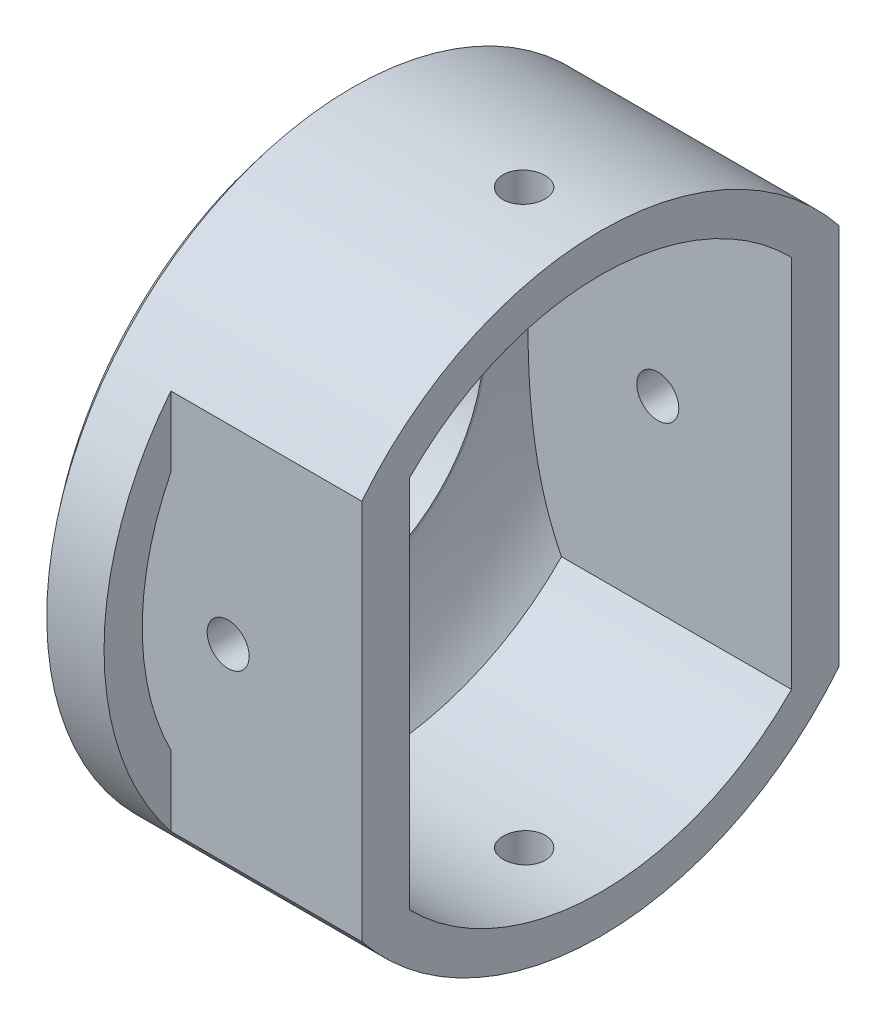
from build123d import *
from build123d.topology import SkipClean

# Parameters (mm, degrees)
SHELL1_T                                   = -2
CUT_EXTRUDE1_REACH                         = 24.978
SKETCH2_R                                  = 7.9
BOSS_EXTRUDE1_DEPTH                        = 10
BOSS_EXTRUDE1_DIRECTION_2_REACH            = 25.409
BOSS_EXTRUDE1_DIRECTION_2_END_MAJOR_RADIUS = 8
BOSS_EXTRUDE1_DIRECTION_2_END_MINOR_RADIUS = 10.166666667
SKETCH4_R                                  = 1.1
CUT_EXTRUDE2_DEPTH                         = 35.179672481
BOSS_EXTRUDE3_DEPTH                        = 10
SKETCH6_R                                  = 1.1
CUT_EXTRUDE3_DEPTH                         = 22.5


with BuildPart() as part:
    # Sketch1 → Revolve1 (revolve)
    with BuildSketch(Plane.XY):
        with BuildLine():
            Line((0, 0), (0, 16))
            Line((0, 16), (-3, 16))
            ThreePointArc((-3, 16), (-5.225338327, 12.272001873), (-6, 8))
            Line((-6, 8), (-6, 0))
            Line((-6, 0), (0, 0))
        make_face()
    revolve(axis=Axis((0, 0, 0), (-1, 0, 0)))

    # Shell1
    shell1_openings = [part.faces().sort_by_distance(p)[0] for p in [
        (0, 0, 0),
    ]]
    offset(amount=SHELL1_T, openings=shell1_openings, kind=Kind.INTERSECTION)

    # Sketch2 → Cut-Extrude1 (cut, up to next)
    with BuildSketch(Plane(origin=(-4, 0, 0), x_dir=(0, 0, -1), z_dir=(1, 0, 0)), mode=Mode.PRIVATE) as cut_extrude1_sk1:
        with Locations(Location((0, 0, 0), (0, 0, 90))):
            Circle(SKETCH2_R)
    cut_extrude1_tool1 = extrude(cut_extrude1_sk1.sketch, amount=-CUT_EXTRUDE1_REACH, mode=Mode.PRIVATE) & part.part
    add(cut_extrude1_tool1.solids().sort_by_distance((-4, 0, 0))[0], mode=Mode.SUBTRACT)

    # Sketch3 → Boss-Extrude1 (add)
    with BuildSketch(Plane(origin=(0, 0, 0), x_dir=(0, 0, -1), z_dir=(1, 0, 0))):
        with BuildLine():
            Line((-10, -9.797958971), (-10, 9.797958971))
            ThreePointArc((-10, 9.797958971), (-11.384775342, 8.14781507), (-12.5, 6.304760106))
            Line((-12.5, 6.304760106), (-12.5, -6.304760106))
            ThreePointArc((-12.5, -6.304760106), (-11.384775342, -8.14781507), (-10, -9.797958971))
        make_face()
        with BuildLine():
            ThreePointArc((12.5, 6.304760106), (11.384775342, 8.14781507), (10, 9.797958971))
            Line((10, 9.797958971), (10, -9.797958971))
            ThreePointArc((10, -9.797958971), (11.384775342, -8.14781507), (12.5, -6.304760106))
            Line((12.5, -6.304760106), (12.5, 6.304760106))
        make_face()
        with BuildLine():
            Line((-10, 9.797958971), (-10, 9.987492178))
            Line((-10, 9.987492178), (-12.5, 9.987492178))
            Line((-12.5, 9.987492178), (-12.5, 6.304760106))
            ThreePointArc((-12.5, 6.304760106), (-11.384775342, 8.14781507), (-10, 9.797958971))
        make_face()
        with BuildLine():
            Line((-10, -9.987492178), (-10, -9.797958971))
            ThreePointArc((-10, -9.797958971), (-11.384775342, -8.14781507), (-12.5, -6.304760106))
            Line((-12.5, -6.304760106), (-12.5, -9.987492178))
            Line((-12.5, -9.987492178), (-10, -9.987492178))
        make_face()
        with BuildLine():
            ThreePointArc((12.5, -6.304760106), (11.384775342, -8.14781507), (10, -9.797958971))
            Line((10, -9.797958971), (10, -9.987492178))
            Line((10, -9.987492178), (12.5, -9.987492178))
            Line((12.5, -9.987492178), (12.5, -6.304760106))
        make_face()
        with BuildLine():
            Line((10, 9.987492178), (10, 9.797958971))
            ThreePointArc((10, 9.797958971), (11.384775342, 8.14781507), (12.5, 6.304760106))
            Line((12.5, 6.304760106), (12.5, 9.987492178))
            Line((12.5, 9.987492178), (10, 9.987492178))
        make_face()
    extrude(amount=BOSS_EXTRUDE1_DEPTH)

    # Boss-Extrude1 direction 2: up to this torus (the profile starts inside it)
    boss_extrude1_direction_2_end = Plane(origin=(6.166666667, 0, 0), z_dir=(1, 0, 0)) * Torus(BOSS_EXTRUDE1_DIRECTION_2_END_MAJOR_RADIUS, BOSS_EXTRUDE1_DIRECTION_2_END_MINOR_RADIUS, mode=Mode.PRIVATE)
    # Sketch3 → Boss-Extrude1 direction 2 (add, up to the surface)
    with BuildSketch(Plane(origin=(0, 0, 0), x_dir=(0, 0, -1), z_dir=(1, 0, 0)), mode=Mode.PRIVATE) as boss_extrude1_direction_2_sk1:
        with BuildLine():
            Line((-10, -9.797958971), (-10, 9.797958971))
            ThreePointArc((-10, 9.797958971), (-11.384775342, 8.14781507), (-12.5, 6.304760106))
            Line((-12.5, 6.304760106), (-12.5, -6.304760106))
            ThreePointArc((-12.5, -6.304760106), (-11.384775342, -8.14781507), (-10, -9.797958971))
        make_face()
    boss_extrude1_direction_2_tool1 = extrude(boss_extrude1_direction_2_sk1.sketch, amount=-BOSS_EXTRUDE1_DIRECTION_2_REACH, mode=Mode.PRIVATE) & boss_extrude1_direction_2_end
    add(boss_extrude1_direction_2_tool1.solids().sort_by_distance((0, 0, 11.16294))[0])
    # Sketch3 → Boss-Extrude1 direction 2 (add, up to the surface)
    with BuildSketch(Plane(origin=(0, 0, 0), x_dir=(0, 0, -1), z_dir=(1, 0, 0)), mode=Mode.PRIVATE) as boss_extrude1_direction_2_sk2:
        with BuildLine():
            ThreePointArc((12.5, 6.304760106), (11.384775342, 8.14781507), (10, 9.797958971))
            Line((10, 9.797958971), (10, -9.797958971))
            ThreePointArc((10, -9.797958971), (11.384775342, -8.14781507), (12.5, -6.304760106))
            Line((12.5, -6.304760106), (12.5, 6.304760106))
        make_face()
    boss_extrude1_direction_2_tool2 = extrude(boss_extrude1_direction_2_sk2.sketch, amount=-BOSS_EXTRUDE1_DIRECTION_2_REACH, mode=Mode.PRIVATE) & boss_extrude1_direction_2_end
    add(boss_extrude1_direction_2_tool2.solids().sort_by_distance((0, 0, -11.16294))[0])
    # Sketch3 → Boss-Extrude1 direction 2 (add, up to the surface)
    with BuildSketch(Plane(origin=(0, 0, 0), x_dir=(0, 0, -1), z_dir=(1, 0, 0)), mode=Mode.PRIVATE) as boss_extrude1_direction_2_sk3:
        with BuildLine():
            Line((-10, 9.797958971), (-10, 9.987492178))
            Line((-10, 9.987492178), (-12.5, 9.987492178))
            Line((-12.5, 9.987492178), (-12.5, 6.304760106))
            ThreePointArc((-12.5, 6.304760106), (-11.384775342, 8.14781507), (-10, 9.797958971))
        make_face()
    boss_extrude1_direction_2_tool3 = extrude(boss_extrude1_direction_2_sk3.sketch, amount=-BOSS_EXTRUDE1_DIRECTION_2_REACH, mode=Mode.PRIVATE) & boss_extrude1_direction_2_end
    add(boss_extrude1_direction_2_tool3.solids().sort_by_distance((0, 8.829417, 11.660924))[0])
    # Sketch3 → Boss-Extrude1 direction 2 (add, up to the surface)
    with BuildSketch(Plane(origin=(0, 0, 0), x_dir=(0, 0, -1), z_dir=(1, 0, 0)), mode=Mode.PRIVATE) as boss_extrude1_direction_2_sk4:
        with BuildLine():
            Line((-10, -9.987492178), (-10, -9.797958971))
            ThreePointArc((-10, -9.797958971), (-11.384775342, -8.14781507), (-12.5, -6.304760106))
            Line((-12.5, -6.304760106), (-12.5, -9.987492178))
            Line((-12.5, -9.987492178), (-10, -9.987492178))
        make_face()
    boss_extrude1_direction_2_tool4 = extrude(boss_extrude1_direction_2_sk4.sketch, amount=-BOSS_EXTRUDE1_DIRECTION_2_REACH, mode=Mode.PRIVATE) & boss_extrude1_direction_2_end
    add(boss_extrude1_direction_2_tool4.solids().sort_by_distance((0, -8.829417, 11.660924))[0])
    # Sketch3 → Boss-Extrude1 direction 2 (add, up to the surface)
    with BuildSketch(Plane(origin=(0, 0, 0), x_dir=(0, 0, -1), z_dir=(1, 0, 0)), mode=Mode.PRIVATE) as boss_extrude1_direction_2_sk5:
        with BuildLine():
            ThreePointArc((12.5, -6.304760106), (11.384775342, -8.14781507), (10, -9.797958971))
            Line((10, -9.797958971), (10, -9.987492178))
            Line((10, -9.987492178), (12.5, -9.987492178))
            Line((12.5, -9.987492178), (12.5, -6.304760106))
        make_face()
    boss_extrude1_direction_2_tool5 = extrude(boss_extrude1_direction_2_sk5.sketch, amount=-BOSS_EXTRUDE1_DIRECTION_2_REACH, mode=Mode.PRIVATE) & boss_extrude1_direction_2_end
    add(boss_extrude1_direction_2_tool5.solids().sort_by_distance((0, -8.829417, -11.660924))[0])
    # Sketch3 → Boss-Extrude1 direction 2 (add, up to the surface)
    with BuildSketch(Plane(origin=(0, 0, 0), x_dir=(0, 0, -1), z_dir=(1, 0, 0)), mode=Mode.PRIVATE) as boss_extrude1_direction_2_sk6:
        with BuildLine():
            Line((10, 9.987492178), (10, 9.797958971))
            ThreePointArc((10, 9.797958971), (11.384775342, 8.14781507), (12.5, 6.304760106))
            Line((12.5, 6.304760106), (12.5, 9.987492178))
            Line((12.5, 9.987492178), (10, 9.987492178))
        make_face()
    boss_extrude1_direction_2_tool6 = extrude(boss_extrude1_direction_2_sk6.sketch, amount=-BOSS_EXTRUDE1_DIRECTION_2_REACH, mode=Mode.PRIVATE) & boss_extrude1_direction_2_end
    add(boss_extrude1_direction_2_tool6.solids().sort_by_distance((0, 8.829417, -11.660924))[0])

    # Sketch4 → Cut-Extrude2 (cut, through all)
    with BuildSketch(Plane.XY.offset(12.5)):
        with Locations((3, 0)):
            Circle(SKETCH4_R)
    extrude(amount=-CUT_EXTRUDE2_DEPTH, mode=Mode.SUBTRACT)

    # Sketch5 → Boss-Extrude3 (add)
    with SkipClean():  # the faces are left unmerged after this step: merging them gives an invalid solid
        with BuildSketch(Plane(origin=(0, 0, 0), x_dir=(0, 0, -1), z_dir=(1, 0, 0))):
            with BuildLine():
                Line((10, 9.797958971), (10, 9.987492178))
                Line((10, 9.987492178), (12.5, 9.987492178))
                ThreePointArc((12.5, 9.987492178), (0, 16), (-12.5, 9.987492178))
                Line((-12.5, 9.987492178), (-10, 9.987492178))
                Line((-10, 9.987492178), (-10, 9.797958971))
                ThreePointArc((-10, 9.797958971), (0, 14), (10, 9.797958971))
            make_face()
            with BuildLine():
                Line((12.5, -9.987492178), (10, -9.987492178))
                Line((10, -9.987492178), (10, -9.797958971))
                ThreePointArc((10, -9.797958971), (0, -14), (-10, -9.797958971))
                Line((-10, -9.797958971), (-10, -9.987492178))
                Line((-10, -9.987492178), (-12.5, -9.987492178))
                ThreePointArc((-12.5, -9.987492178), (0, -16), (12.5, -9.987492178))
            make_face()
        extrude(amount=BOSS_EXTRUDE3_DEPTH)

    # Sketch6 → Cut-Extrude3 (cut, symmetric)
    with SkipClean():  # the faces are left unmerged after this step: merging them gives an invalid solid
        with BuildSketch(Plane(origin=(0, 0, 0), x_dir=(1, 0, 0), z_dir=(0, 1, 0))):
            with Locations(Location((6, 0, 0), (0, 0, 270))):
                Circle(SKETCH6_R)
        extrude(amount=CUT_EXTRUDE3_DEPTH, both=True, mode=Mode.SUBTRACT)


solid = part.part
